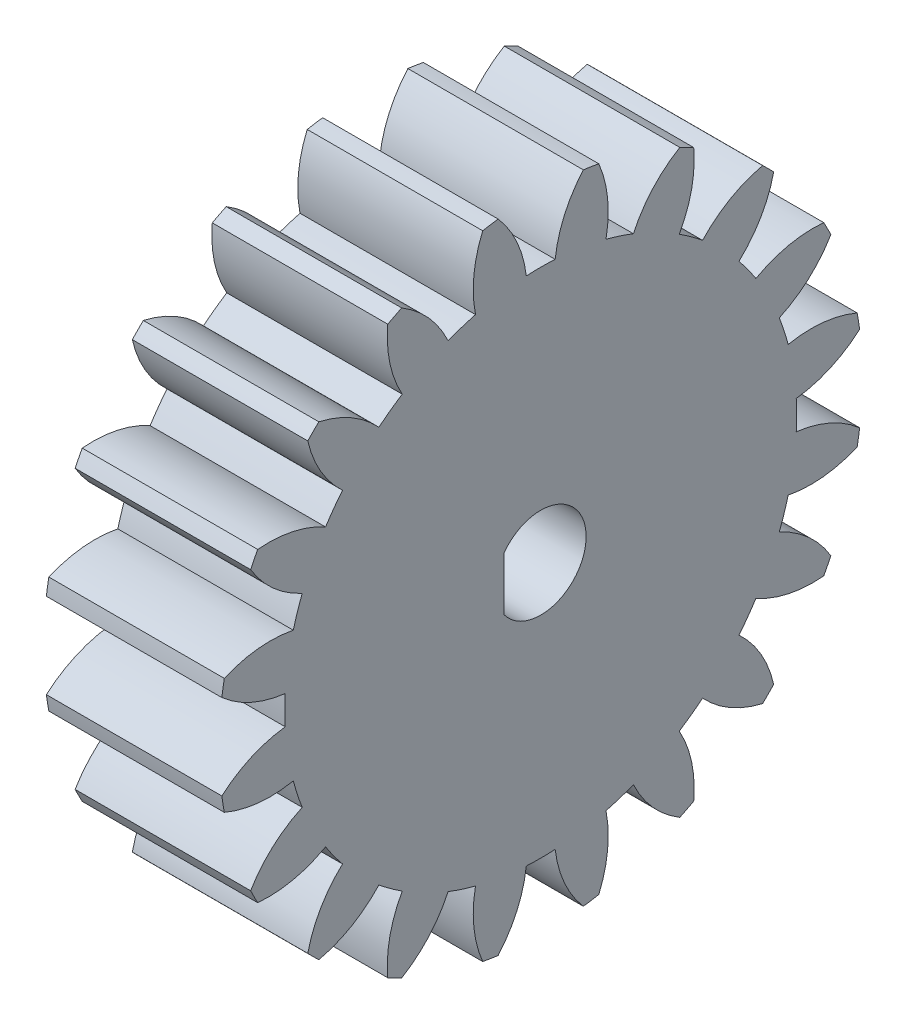
from build123d import *

# Parameters (mm, degrees)
BASPROSKE_W           = 12
BASPROSKE_H           = 22
TOOTHCUT_DEPTH        = 34.346664001
TEETHCUTS_COUNT       = 20
TEETHCUTS_ANGLE       = 342
BORSKE_R              = 0.4
BORE_DEPTH            = 50.0000508
KES_EKSTR_ZYON1_DEPTH = 100


with BuildPart() as part:
    # BasProSke → Base-Revolve (revolve)
    with BuildSketch(Plane(origin=(0, 0, 0), x_dir=(1, 0, 0), z_dir=(0, 1, 0)), mode=Mode.PRIVATE) as base_revolve_sk:
        with Locations((6, 11)):
            Rectangle(BASPROSKE_W, BASPROSKE_H)
    revolve(base_revolve_sk.sketch.rotate(Axis((-10, 0, 0), (1, 0, 0)), 180), axis=Axis((-10, 0, 0), (1, 0, 0)))

    # TooCutSke → ToothCut (cut, through all)
    with BuildSketch(Plane(origin=(0, 0, 0), x_dir=(0, 0, -1), z_dir=(1, 0, 0))):
        with BuildLine():
            ThreePointArc((0.986171591, 17.471189616), (0, 17.499), (-0.986171591, 17.471189616))
            ThreePointArc((-0.986171591, 17.471189616), (-1.626916196, 19.798789858), (-2.932850173, 21.829260982))
            ThreePointArc((-2.932850173, 21.829260982), (0, 22.0254), (2.932850173, 21.829260982))
            ThreePointArc((2.932850173, 21.829260982), (1.626916196, 19.798789858), (0.986171591, 17.471189616))
        make_face()
    toothcut = extrude(amount=TOOTHCUT_DEPTH, mode=Mode.SUBTRACT)

    # TeethCuts: ToothCut ×20 about axis
    teethcuts_axis = Axis((-10, 0, 0), (1, 0, 0))
    for i in range(1, TEETHCUTS_COUNT):
        add(toothcut.rotate(teethcuts_axis, i * TEETHCUTS_ANGLE / (TEETHCUTS_COUNT - 1)), mode=Mode.SUBTRACT)

    # BorSke → Bore (cut, symmetric)
    with BuildSketch(Plane(origin=(0, 0, 0), x_dir=(0, 0, -1), z_dir=(1, 0, 0))):
        with Locations(Location((0, 0, 0), (0, 0, 180))):
            Circle(BORSKE_R)
    extrude(amount=BORE_DEPTH, both=True, mode=Mode.SUBTRACT)

    # Çizim1 → Kes-Ekstrüzyon1 (cut)
    with BuildSketch(Plane(origin=(12, 0, 0), x_dir=(0, 0, -1), z_dir=(1, 0, 0))):
        with BuildLine():
            ThreePointArc((3.105, 0), (0.947725377, 2.956829655), (-2.526459974, 1.805))
            Line((-2.526459974, 1.805), (-2.526459974, -1.805))
            ThreePointArc((-2.526459974, -1.805), (0.947725377, -2.956829655), (3.105, 0))
        make_face()
    extrude(amount=-KES_EKSTR_ZYON1_DEPTH, mode=Mode.SUBTRACT)


solid = part.part
